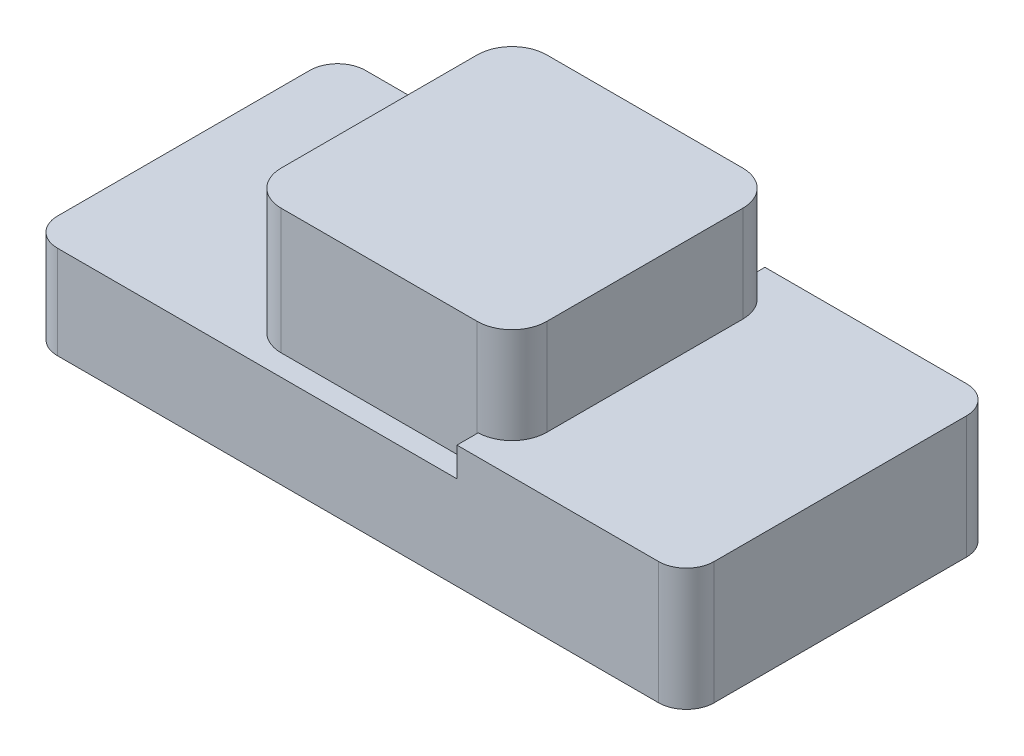
from build123d import *

# Parameters (mm, degrees)
BOSS_EXTRUDE1_DEPTH = 44.3
SKETCH2_W           = 38.2
SKETCH2_H           = 38.2
BOSS_EXTRUDE2_DEPTH = 18.02
FILLET1_R           = 5
FILLET2_R           = 4


with BuildPart() as part:
    # Sketch1 → Boss-Extrude1 (new body)
    with BuildSketch(Plane.XY):
        Polygon((0, 0), (-77.858285242, 0), (-77.858285242, 13.4), (-16.398285242, 13.4), (-16.398285242, 17.6), (16.601714758, 17.6), (16.601714758, 0), align=None)
    extrude(amount=BOSS_EXTRUDE1_DEPTH)

    # Sketch2 → Boss-Extrude2 (add)
    with BuildSketch(Plane(origin=(0, 13.4, 0), x_dir=(1, 0, 0), z_dir=(0, 1, 0))):
        with Locations((-30.628285242, -22.15)):
            Rectangle(SKETCH2_W, SKETCH2_H)
    extrude(amount=BOSS_EXTRUDE2_DEPTH)

    # Fillet1
    fillet1_edges = [part.edges().sort_by_distance(p)[0] for p in [
        (-49.728285242, 22.41, 3.05),
        (-11.528285242, 24.51, 3.05),
        (-11.528285242, 24.51, 41.25),
        (-49.728285242, 22.41, 41.25),
    ]]
    fillet(fillet1_edges, radius=FILLET1_R)

    # Fillet2
    fillet2_edges = [part.edges().sort_by_distance(p)[0] for p in [
        (-77.858285242, 6.7, 44.3),
        (-77.858285242, 6.7, 0),
        (16.601714758, 8.8, 44.3),
        (16.601714758, 8.8, 0),
    ]]
    fillet(fillet2_edges, radius=FILLET2_R)


solid = part.part
